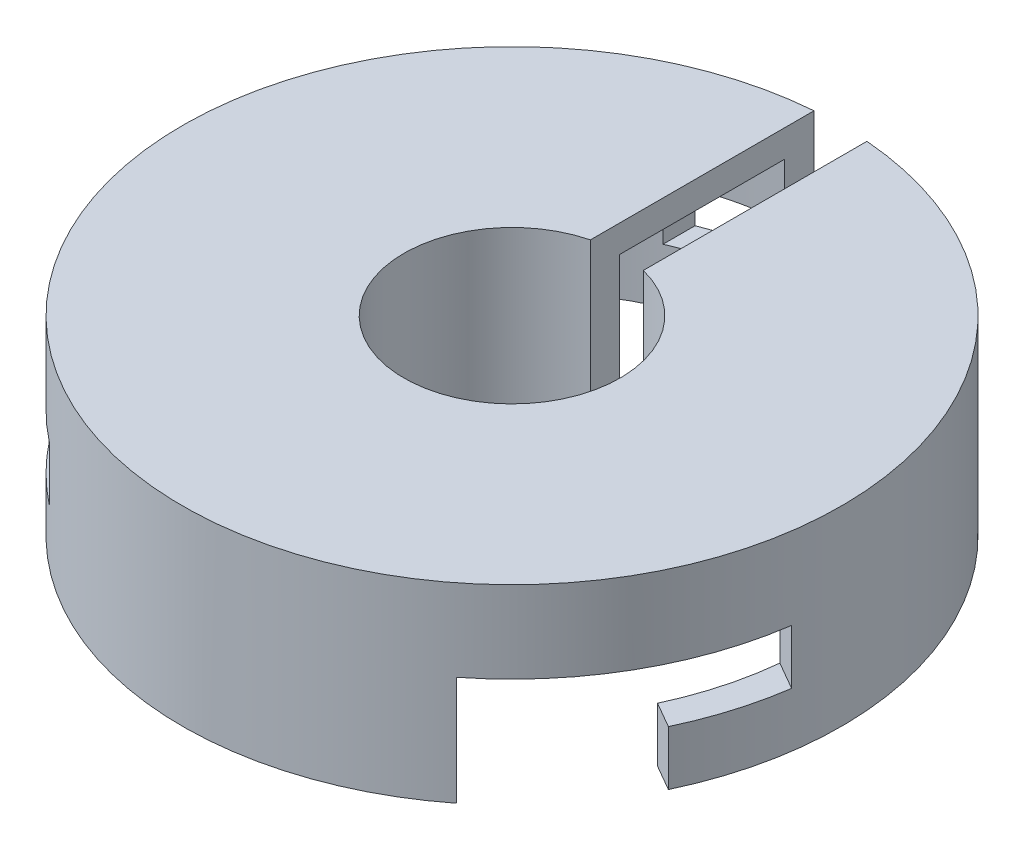
from build123d import *

# Parameters (mm, degrees)
BOSS_EXTRUDE3_DEPTH = 7
BOSS_EXTRUDE4_DEPTH = 1
BOSS_EXTRUDE5_DEPTH = 7
BOSS_EXTRUDE6_DEPTH = 3
BOSS_EXTRUDE7_START = -5
BOSS_EXTRUDE7_DEPTH = 2


with BuildPart() as part:
    # Sketch1 → Boss-Extrude3 (new body)
    with BuildSketch(Plane(origin=(0, 0, 0), x_dir=(1, 0, 0), z_dir=(0, 1, 0))):
        with BuildLine():
            Line((0.970071849, 4.904993436), (0.970071849, 3.843317436))
            ThreePointArc((0.970071849, 3.843317436), (0, -3.96385271), (-0.970071849, 3.843317436))
            Line((-0.970071849, 3.843317436), (-0.970071849, 4.904993436))
            ThreePointArc((-0.970071849, 4.904993436), (0, -5), (0.970071849, 4.904993436))
        make_face()
    extrude(amount=-BOSS_EXTRUDE3_DEPTH)

    # Sketch1<6> → Boss-Extrude4 (add)
    with BuildSketch(Plane(origin=(0, 0, 0), x_dir=(1, 0, 0), z_dir=(0, 1, 0))):
        with BuildLine():
            Line((0.970071849, 10.957141991), (0.970071849, 4.904993436))
            ThreePointArc((0.970071849, 4.904993436), (0, -5), (-0.970071849, 4.904993436))
            Line((-0.970071849, 4.904993436), (-0.970071849, 10.957141991))
            ThreePointArc((-0.970071849, 10.957141991), (0, -11), (0.970071849, 10.957141991))
        make_face()
    extrude(amount=-BOSS_EXTRUDE4_DEPTH)

    # Sketch1<7> → Boss-Extrude5 (add)
    with BuildSketch(Plane(origin=(0, 0, 0), x_dir=(1, 0, 0), z_dir=(0, 1, 0))):
        with BuildLine():
            ThreePointArc((-7.460787851, -9.503640297), (0, -12.082323214), (7.460787851, -9.503640297))
            Line((7.460787851, -9.503640297), (6.442669325, -8.915829292))
            ThreePointArc((6.442669325, -8.915829292), (0, -11), (-6.442669325, -8.915829292))
            Line((-6.442669325, -8.915829292), (-7.460787851, -9.503640297))
        make_face()
        with BuildLine():
            Line((10.942669325, -1.121600658), (11.960787851, -1.709411663))
            ThreePointArc((11.960787851, -1.709411663), (12.051901073, -0.856863332), (12.082323214, 0))
            ThreePointArc((12.082323214, 0), (10.008820827, 6.768015949), (4.5, 11.21305196))
            Line((4.5, 11.21305196), (4.5, 10.03742995))
            ThreePointArc((4.5, 10.03742995), (9.233092656, 5.979130372), (11, 0))
            ThreePointArc((11, 0), (10.985657982, -0.561532466), (10.942669325, -1.121600658))
        make_face()
        with BuildLine():
            ThreePointArc((-4.5, 11.21305196), (-10.46359884, 6.041161607), (-11.960787851, -1.709411663))
            Line((-11.960787851, -1.709411663), (-10.942669325, -1.121600658))
            ThreePointArc((-10.942669325, -1.121600658), (-9.526279442, 5.5), (-4.5, 10.03742995))
            Line((-4.5, 10.03742995), (-4.5, 11.21305196))
        make_face()
    extrude(amount=-BOSS_EXTRUDE5_DEPTH)

    # Sketch1<8> → Boss-Extrude6 (add)
    with BuildSketch(Plane(origin=(0, 0, 0), x_dir=(1, 0, 0), z_dir=(0, 1, 0))):
        with BuildLine():
            Line((11.960787851, -1.709411663), (10.942669325, -1.121600658))
            ThreePointArc((10.942669325, -1.121600658), (9.526279442, -5.5), (6.442669325, -8.915829292))
            Line((6.442669325, -8.915829292), (7.460787851, -9.503640297))
            ThreePointArc((7.460787851, -9.503640297), (10.46359884, -6.041161607), (11.960787851, -1.709411663))
        make_face()
        with BuildLine():
            Line((4.5, 10.03742995), (4.5, 11.21305196))
            ThreePointArc((4.5, 11.21305196), (2.766361636, 11.761368014), (0.970071849, 12.043317436))
            Line((0.970071849, 12.043317436), (0.970071849, 10.957141991))
            ThreePointArc((0.970071849, 10.957141991), (2.773425512, 10.644628267), (4.5, 10.03742995))
        make_face()
        with BuildLine():
            Line((-7.460787851, -9.503640297), (-6.442669325, -8.915829292))
            ThreePointArc((-6.442669325, -8.915829292), (-9.526279442, -5.5), (-10.942669325, -1.121600658))
            Line((-10.942669325, -1.121600658), (-11.960787851, -1.709411663))
            ThreePointArc((-11.960787851, -1.709411663), (-10.46359884, -6.041161607), (-7.460787851, -9.503640297))
        make_face()
        with BuildLine():
            Line((-0.970071849, 10.957141991), (-0.970071849, 12.043317436))
            ThreePointArc((-0.970071849, 12.043317436), (-2.766361636, 11.761368014), (-4.5, 11.21305196))
            Line((-4.5, 11.21305196), (-4.5, 10.03742995))
            ThreePointArc((-4.5, 10.03742995), (-2.773425512, 10.644628267), (-0.970071849, 10.957141991))
        make_face()
    extrude(amount=-BOSS_EXTRUDE6_DEPTH)

    # Sketch1<9> → Boss-Extrude7 (add)
    with BuildSketch(Plane(origin=(0, 0, 0), x_dir=(1, 0, 0), z_dir=(0, 1, 0)).offset(BOSS_EXTRUDE7_START)):
        with BuildLine():
            ThreePointArc((-9.944782921, -6.861765583), (-8.802462665, -8.276423459), (-7.460787851, -9.503640297))
            Line((-7.460787851, -9.503640297), (-6.442669325, -8.915829292))
            ThreePointArc((-6.442669325, -8.915829292), (-7.831805737, -7.724171082), (-9.004127392, -6.31867786))
            Line((-9.004127392, -6.31867786), (-9.944782921, -6.861765583))
        make_face()
        with BuildLine():
            ThreePointArc((10.91485477, -5.181551853), (11.568824301, -3.484944554), (11.960787851, -1.709411663))
            Line((11.960787851, -1.709411663), (10.942669325, -1.121600658))
            ThreePointArc((10.942669325, -1.121600658), (10.605231248, -2.920457185), (9.974199241, -4.638464131))
            Line((9.974199241, -4.638464131), (10.91485477, -5.181551853))
        make_face()
        with BuildLine():
            Line((-0.970071849, 10.957141991), (-0.970071849, 12.043317436))
            ThreePointArc((-0.970071849, 12.043317436), (-2.766361636, 11.761368014), (-4.5, 11.21305196))
            Line((-4.5, 11.21305196), (-4.5, 10.03742995))
            ThreePointArc((-4.5, 10.03742995), (-2.773425512, 10.644628267), (-0.970071849, 10.957141991))
        make_face()
    extrude(amount=-BOSS_EXTRUDE7_DEPTH)


solid = part.part
